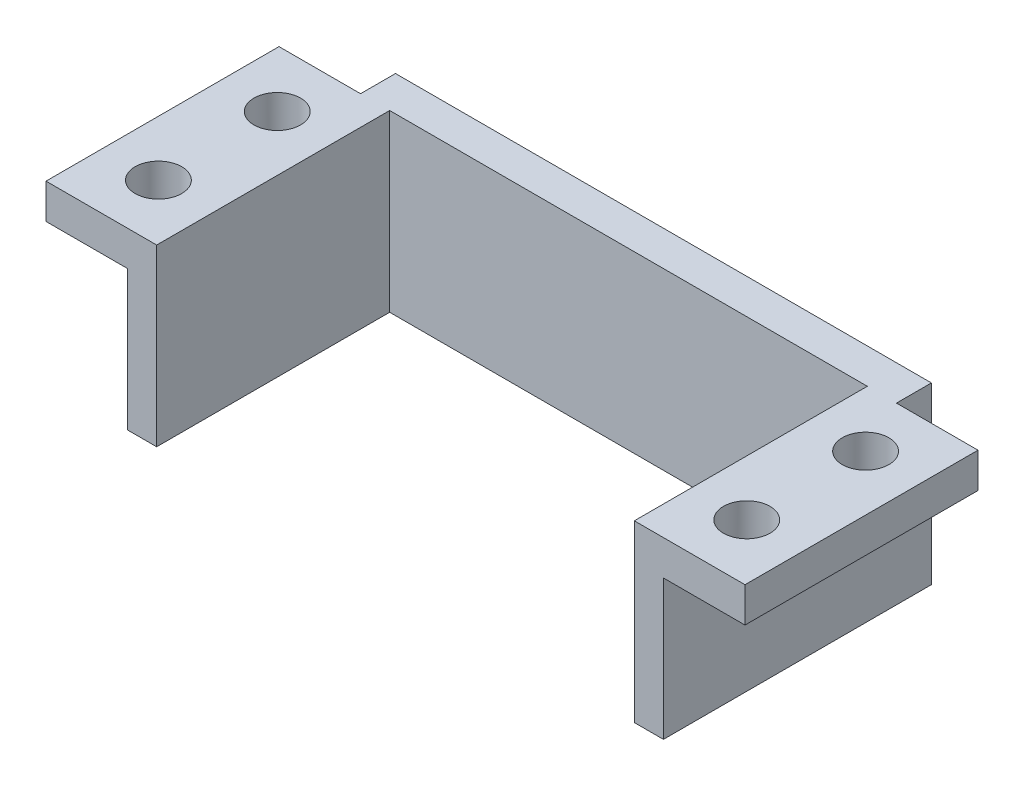
from build123d import *

# Parameters (mm, degrees)
SKETCH1_W           = 46
SKETCH1_H           = 15
BOSS_EXTRUDE1_DEPTH = 3
SKETCH3_W           = 2.5
SKETCH3_H           = 15
BOSS_EXTRUDE2_DEPTH = 20
SKETCH4_W           = 20
SKETCH4_H           = 3
BOSS_EXTRUDE3_DEPTH = 7
SKETCH5_R           = 2
CUT_EXTRUDE1_DEPTH  = 7


with BuildPart() as part:
    # Sketch1 → Boss-Extrude1 (new body)
    with BuildSketch(Plane.XY):
        with Locations((23, 7.5)):
            Rectangle(SKETCH1_W, SKETCH1_H)
    extrude(amount=BOSS_EXTRUDE1_DEPTH)

    # Sketch3 → Boss-Extrude2 (add)
    with BuildSketch(Plane.XY.offset(3)):
        with Locations((1.25, 7.5)):
            Rectangle(SKETCH3_W, SKETCH3_H)
    boss_extrude2 = extrude(amount=BOSS_EXTRUDE2_DEPTH)

    # Sketch4 → Boss-Extrude3 (add)
    with BuildSketch(Plane.ZY):
        with Locations((13, 13.5)):
            Rectangle(SKETCH4_W, SKETCH4_H)
    boss_extrude3 = extrude(amount=BOSS_EXTRUDE3_DEPTH)

    # Sketch5 → Cut-Extrude1 (cut)
    with BuildSketch(Plane(origin=(0, 15, 0), x_dir=(1, 0, 0), z_dir=(0, 1, 0))):
        with Locations(Location((-2.25, -18.1, 0), (0, 0, 270))):
            Circle(SKETCH5_R)
        with Locations(Location((-2.25, -7.9, 0), (0, 0, 270))):
            Circle(SKETCH5_R)
    cut_extrude1 = extrude(amount=-CUT_EXTRUDE1_DEPTH, mode=Mode.SUBTRACT)

    # Mirror1: Boss-Extrude2, Boss-Extrude3, Cut-Extrude1 across plane
    add(boss_extrude2.mirror(Plane(origin=(23, 0, 0), x_dir=(0, 0, 1), z_dir=(1, 0, 0))))
    add(boss_extrude3.mirror(Plane(origin=(23, 0, 0), x_dir=(0, 0, 1), z_dir=(1, 0, 0))))
    add(cut_extrude1.mirror(Plane(origin=(23, 0, 0), x_dir=(0, 0, 1), z_dir=(1, 0, 0))), mode=Mode.SUBTRACT)


solid = part.part
